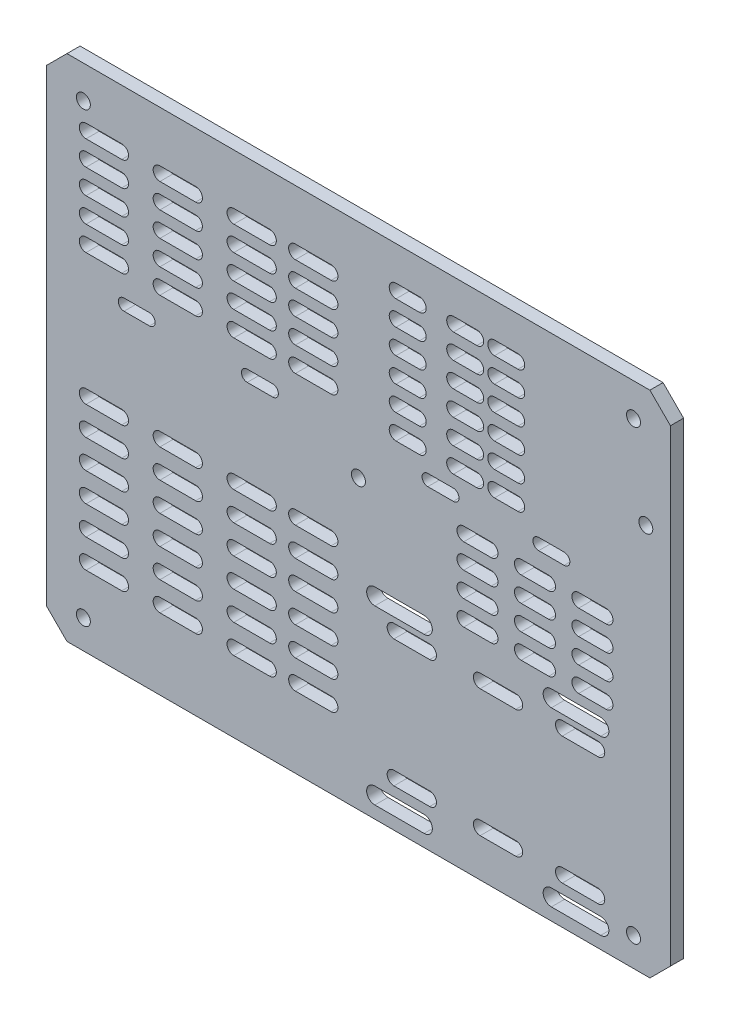
from build123d import *

# Parameters (mm, degrees)
F_3_2_MOUNTING_PLATE_SCREW_AND_STRAP_2_R       = 1.7
F_3_2_MOUNTING_PLATE_SCREW_AND_STRAP_THR_DEPTH = 3.2


with BuildPart() as part:
    # 3.2 mounting plate - screw and strap 2 → 3.2 mounting plate - screw and strap thr (new body)
    with BuildSketch(Plane.XY):
        Polygon((-71, -62), (71, -62), (76, -57), (76, 57), (71, 62), (-71, 62), (-76, 57), (-76, -57), align=None)
        with Locations((-67, -55)):
            Circle(F_3_2_MOUNTING_PLATE_SCREW_AND_STRAP_2_R, mode=Mode.SUBTRACT)
        with Locations((-67, 54)):
            Circle(F_3_2_MOUNTING_PLATE_SCREW_AND_STRAP_2_R, mode=Mode.SUBTRACT)
        with Locations((67, -55)):
            Circle(F_3_2_MOUNTING_PLATE_SCREW_AND_STRAP_2_R, mode=Mode.SUBTRACT)
        with Locations((67, 54)):
            Circle(F_3_2_MOUNTING_PLATE_SCREW_AND_STRAP_2_R, mode=Mode.SUBTRACT)
        with Locations((0, 8)):
            Circle(F_3_2_MOUNTING_PLATE_SCREW_AND_STRAP_2_R, mode=Mode.SUBTRACT)
        with Locations((70, 33)):
            Circle(F_3_2_MOUNTING_PLATE_SCREW_AND_STRAP_2_R, mode=Mode.SUBTRACT)
        with BuildLine():
            Line((-66.35, 22.35), (-57.65, 22.35))
            ThreePointArc((-57.65, 22.35), (-56, 24), (-57.65, 25.65))
            Line((-57.65, 25.65), (-66.35, 25.65))
            ThreePointArc((-66.35, 25.65), (-68, 24), (-66.35, 22.35))
        make_face(mode=Mode.SUBTRACT)
        with BuildLine():
            Line((-48.35, 22.35), (-39.65, 22.35))
            ThreePointArc((-39.65, 22.35), (-38, 24), (-39.65, 25.65))
            Line((-39.65, 25.65), (-48.35, 25.65))
            ThreePointArc((-48.35, 25.65), (-50, 24), (-48.35, 22.35))
        make_face(mode=Mode.SUBTRACT)
        with BuildLine():
            Line((-30.35, 22.35), (-21.65, 22.35))
            ThreePointArc((-21.65, 22.35), (-20, 24), (-21.65, 25.65))
            Line((-21.65, 25.65), (-30.35, 25.65))
            ThreePointArc((-30.35, 25.65), (-32, 24), (-30.35, 22.35))
        make_face(mode=Mode.SUBTRACT)
        with BuildLine():
            Line((-15.35, 22.35), (-6.65, 22.35))
            ThreePointArc((-6.65, 22.35), (-5, 24), (-6.65, 25.65))
            Line((-6.65, 25.65), (-15.35, 25.65))
            ThreePointArc((-15.35, 25.65), (-17, 24), (-15.35, 22.35))
        make_face(mode=Mode.SUBTRACT)
        with BuildLine():
            Line((-66.35, 28.35), (-57.65, 28.35))
            ThreePointArc((-57.65, 28.35), (-56, 30), (-57.65, 31.65))
            Line((-57.65, 31.65), (-66.35, 31.65))
            ThreePointArc((-66.35, 31.65), (-68, 30), (-66.35, 28.35))
        make_face(mode=Mode.SUBTRACT)
        with BuildLine():
            Line((-48.35, 28.35), (-39.65, 28.35))
            ThreePointArc((-39.65, 28.35), (-38, 30), (-39.65, 31.65))
            Line((-39.65, 31.65), (-48.35, 31.65))
            ThreePointArc((-48.35, 31.65), (-50, 30), (-48.35, 28.35))
        make_face(mode=Mode.SUBTRACT)
        with BuildLine():
            Line((-30.35, 28.35), (-21.65, 28.35))
            ThreePointArc((-21.65, 28.35), (-20, 30), (-21.65, 31.65))
            Line((-21.65, 31.65), (-30.35, 31.65))
            ThreePointArc((-30.35, 31.65), (-32, 30), (-30.35, 28.35))
        make_face(mode=Mode.SUBTRACT)
        with BuildLine():
            Line((-15.35, 28.35), (-6.65, 28.35))
            ThreePointArc((-6.65, 28.35), (-5, 30), (-6.65, 31.65))
            Line((-6.65, 31.65), (-15.35, 31.65))
            ThreePointArc((-15.35, 31.65), (-17, 30), (-15.35, 28.35))
        make_face(mode=Mode.SUBTRACT)
        with BuildLine():
            Line((-66.35, 34.35), (-57.65, 34.35))
            ThreePointArc((-57.65, 34.35), (-56, 36), (-57.65, 37.65))
            Line((-57.65, 37.65), (-66.35, 37.65))
            ThreePointArc((-66.35, 37.65), (-68, 36), (-66.35, 34.35))
        make_face(mode=Mode.SUBTRACT)
        with BuildLine():
            Line((-48.35, 34.35), (-39.65, 34.35))
            ThreePointArc((-39.65, 34.35), (-38, 36), (-39.65, 37.65))
            Line((-39.65, 37.65), (-48.35, 37.65))
            ThreePointArc((-48.35, 37.65), (-50, 36), (-48.35, 34.35))
        make_face(mode=Mode.SUBTRACT)
        with BuildLine():
            Line((-30.35, 34.35), (-21.65, 34.35))
            ThreePointArc((-21.65, 34.35), (-20, 36), (-21.65, 37.65))
            Line((-21.65, 37.65), (-30.35, 37.65))
            ThreePointArc((-30.35, 37.65), (-32, 36), (-30.35, 34.35))
        make_face(mode=Mode.SUBTRACT)
        with BuildLine():
            Line((-15.35, 34.35), (-6.65, 34.35))
            ThreePointArc((-6.65, 34.35), (-5, 36), (-6.65, 37.65))
            Line((-6.65, 37.65), (-15.35, 37.65))
            ThreePointArc((-15.35, 37.65), (-17, 36), (-15.35, 34.35))
        make_face(mode=Mode.SUBTRACT)
        with BuildLine():
            Line((-66.35, 40.35), (-57.65, 40.35))
            ThreePointArc((-57.65, 40.35), (-56, 42), (-57.65, 43.65))
            Line((-57.65, 43.65), (-66.35, 43.65))
            ThreePointArc((-66.35, 43.65), (-68, 42), (-66.35, 40.35))
        make_face(mode=Mode.SUBTRACT)
        with BuildLine():
            Line((-48.35, 40.35), (-39.65, 40.35))
            ThreePointArc((-39.65, 40.35), (-38, 42), (-39.65, 43.65))
            Line((-39.65, 43.65), (-48.35, 43.65))
            ThreePointArc((-48.35, 43.65), (-50, 42), (-48.35, 40.35))
        make_face(mode=Mode.SUBTRACT)
        with BuildLine():
            Line((-30.35, 40.35), (-21.65, 40.35))
            ThreePointArc((-21.65, 40.35), (-20, 42), (-21.65, 43.65))
            Line((-21.65, 43.65), (-30.35, 43.65))
            ThreePointArc((-30.35, 43.65), (-32, 42), (-30.35, 40.35))
        make_face(mode=Mode.SUBTRACT)
        with BuildLine():
            Line((-15.35, 40.35), (-6.65, 40.35))
            ThreePointArc((-6.65, 40.35), (-5, 42), (-6.65, 43.65))
            Line((-6.65, 43.65), (-15.35, 43.65))
            ThreePointArc((-15.35, 43.65), (-17, 42), (-15.35, 40.35))
        make_face(mode=Mode.SUBTRACT)
        with BuildLine():
            Line((-66.35, 46.35), (-57.65, 46.35))
            ThreePointArc((-57.65, 46.35), (-56, 48), (-57.65, 49.65))
            Line((-57.65, 49.65), (-66.35, 49.65))
            ThreePointArc((-66.35, 49.65), (-68, 48), (-66.35, 46.35))
        make_face(mode=Mode.SUBTRACT)
        with BuildLine():
            Line((-48.35, 46.35), (-39.65, 46.35))
            ThreePointArc((-39.65, 46.35), (-38, 48), (-39.65, 49.65))
            Line((-39.65, 49.65), (-48.35, 49.65))
            ThreePointArc((-48.35, 49.65), (-50, 48), (-48.35, 46.35))
        make_face(mode=Mode.SUBTRACT)
        with BuildLine():
            Line((-30.35, 46.35), (-21.65, 46.35))
            ThreePointArc((-21.65, 46.35), (-20, 48), (-21.65, 49.65))
            Line((-21.65, 49.65), (-30.35, 49.65))
            ThreePointArc((-30.35, 49.65), (-32, 48), (-30.35, 46.35))
        make_face(mode=Mode.SUBTRACT)
        with BuildLine():
            Line((-15.35, 46.35), (-6.65, 46.35))
            ThreePointArc((-6.65, 46.35), (-5, 48), (-6.65, 49.65))
            Line((-6.65, 49.65), (-15.35, 49.65))
            ThreePointArc((-15.35, 49.65), (-17, 48), (-15.35, 46.35))
        make_face(mode=Mode.SUBTRACT)
        with BuildLine():
            Line((-66.35, -44.65), (-57.65, -44.65))
            ThreePointArc((-57.65, -44.65), (-56, -43), (-57.65, -41.35))
            Line((-57.65, -41.35), (-66.35, -41.35))
            ThreePointArc((-66.35, -41.35), (-68, -43), (-66.35, -44.65))
        make_face(mode=Mode.SUBTRACT)
        with BuildLine():
            Line((-48.35, -44.65), (-39.65, -44.65))
            ThreePointArc((-39.65, -44.65), (-38, -43), (-39.65, -41.35))
            Line((-39.65, -41.35), (-48.35, -41.35))
            ThreePointArc((-48.35, -41.35), (-50, -43), (-48.35, -44.65))
        make_face(mode=Mode.SUBTRACT)
        with BuildLine():
            Line((-30.35, -44.65), (-21.65, -44.65))
            ThreePointArc((-21.65, -44.65), (-20, -43), (-21.65, -41.35))
            Line((-21.65, -41.35), (-30.35, -41.35))
            ThreePointArc((-30.35, -41.35), (-32, -43), (-30.35, -44.65))
        make_face(mode=Mode.SUBTRACT)
        with BuildLine():
            Line((-15.35, -44.65), (-6.65, -44.65))
            ThreePointArc((-6.65, -44.65), (-5, -43), (-6.65, -41.35))
            Line((-6.65, -41.35), (-15.35, -41.35))
            ThreePointArc((-15.35, -41.35), (-17, -43), (-15.35, -44.65))
        make_face(mode=Mode.SUBTRACT)
        with BuildLine():
            Line((-66.35, -37.65), (-57.65, -37.65))
            ThreePointArc((-57.65, -37.65), (-56, -36), (-57.65, -34.35))
            Line((-57.65, -34.35), (-66.35, -34.35))
            ThreePointArc((-66.35, -34.35), (-68, -36), (-66.35, -37.65))
        make_face(mode=Mode.SUBTRACT)
        with BuildLine():
            Line((-48.35, -37.65), (-39.65, -37.65))
            ThreePointArc((-39.65, -37.65), (-38, -36), (-39.65, -34.35))
            Line((-39.65, -34.35), (-48.35, -34.35))
            ThreePointArc((-48.35, -34.35), (-50, -36), (-48.35, -37.65))
        make_face(mode=Mode.SUBTRACT)
        with BuildLine():
            Line((-30.35, -37.65), (-21.65, -37.65))
            ThreePointArc((-21.65, -37.65), (-20, -36), (-21.65, -34.35))
            Line((-21.65, -34.35), (-30.35, -34.35))
            ThreePointArc((-30.35, -34.35), (-32, -36), (-30.35, -37.65))
        make_face(mode=Mode.SUBTRACT)
        with BuildLine():
            Line((-15.35, -37.65), (-6.65, -37.65))
            ThreePointArc((-6.65, -37.65), (-5, -36), (-6.65, -34.35))
            Line((-6.65, -34.35), (-15.35, -34.35))
            ThreePointArc((-15.35, -34.35), (-17, -36), (-15.35, -37.65))
        make_face(mode=Mode.SUBTRACT)
        with BuildLine():
            Line((-66.35, -30.65), (-57.65, -30.65))
            ThreePointArc((-57.65, -30.65), (-56, -29), (-57.65, -27.35))
            Line((-57.65, -27.35), (-66.35, -27.35))
            ThreePointArc((-66.35, -27.35), (-68, -29), (-66.35, -30.65))
        make_face(mode=Mode.SUBTRACT)
        with BuildLine():
            Line((-48.35, -30.65), (-39.65, -30.65))
            ThreePointArc((-39.65, -30.65), (-38, -29), (-39.65, -27.35))
            Line((-39.65, -27.35), (-48.35, -27.35))
            ThreePointArc((-48.35, -27.35), (-50, -29), (-48.35, -30.65))
        make_face(mode=Mode.SUBTRACT)
        with BuildLine():
            Line((-30.35, -30.65), (-21.65, -30.65))
            ThreePointArc((-21.65, -30.65), (-20, -29), (-21.65, -27.35))
            Line((-21.65, -27.35), (-30.35, -27.35))
            ThreePointArc((-30.35, -27.35), (-32, -29), (-30.35, -30.65))
        make_face(mode=Mode.SUBTRACT)
        with BuildLine():
            Line((-15.35, -30.65), (-6.65, -30.65))
            ThreePointArc((-6.65, -30.65), (-5, -29), (-6.65, -27.35))
            Line((-6.65, -27.35), (-15.35, -27.35))
            ThreePointArc((-15.35, -27.35), (-17, -29), (-15.35, -30.65))
        make_face(mode=Mode.SUBTRACT)
        with BuildLine():
            Line((-66.35, -23.65), (-57.65, -23.65))
            ThreePointArc((-57.65, -23.65), (-56, -22), (-57.65, -20.35))
            Line((-57.65, -20.35), (-66.35, -20.35))
            ThreePointArc((-66.35, -20.35), (-68, -22), (-66.35, -23.65))
        make_face(mode=Mode.SUBTRACT)
        with BuildLine():
            Line((-48.35, -23.65), (-39.65, -23.65))
            ThreePointArc((-39.65, -23.65), (-38, -22), (-39.65, -20.35))
            Line((-39.65, -20.35), (-48.35, -20.35))
            ThreePointArc((-48.35, -20.35), (-50, -22), (-48.35, -23.65))
        make_face(mode=Mode.SUBTRACT)
        with BuildLine():
            Line((-30.35, -23.65), (-21.65, -23.65))
            ThreePointArc((-21.65, -23.65), (-20, -22), (-21.65, -20.35))
            Line((-21.65, -20.35), (-30.35, -20.35))
            ThreePointArc((-30.35, -20.35), (-32, -22), (-30.35, -23.65))
        make_face(mode=Mode.SUBTRACT)
        with BuildLine():
            Line((-15.35, -23.65), (-6.65, -23.65))
            ThreePointArc((-6.65, -23.65), (-5, -22), (-6.65, -20.35))
            Line((-6.65, -20.35), (-15.35, -20.35))
            ThreePointArc((-15.35, -20.35), (-17, -22), (-15.35, -23.65))
        make_face(mode=Mode.SUBTRACT)
        with BuildLine():
            Line((-66.35, -16.65), (-57.65, -16.65))
            ThreePointArc((-57.65, -16.65), (-56, -15), (-57.65, -13.35))
            Line((-57.65, -13.35), (-66.35, -13.35))
            ThreePointArc((-66.35, -13.35), (-68, -15), (-66.35, -16.65))
        make_face(mode=Mode.SUBTRACT)
        with BuildLine():
            Line((-48.35, -16.65), (-39.65, -16.65))
            ThreePointArc((-39.65, -16.65), (-38, -15), (-39.65, -13.35))
            Line((-39.65, -13.35), (-48.35, -13.35))
            ThreePointArc((-48.35, -13.35), (-50, -15), (-48.35, -16.65))
        make_face(mode=Mode.SUBTRACT)
        with BuildLine():
            Line((-30.35, -16.65), (-21.65, -16.65))
            ThreePointArc((-21.65, -16.65), (-20, -15), (-21.65, -13.35))
            Line((-21.65, -13.35), (-30.35, -13.35))
            ThreePointArc((-30.35, -13.35), (-32, -15), (-30.35, -16.65))
        make_face(mode=Mode.SUBTRACT)
        with BuildLine():
            Line((-15.35, -16.65), (-6.65, -16.65))
            ThreePointArc((-6.65, -16.65), (-5, -15), (-6.65, -13.35))
            Line((-6.65, -13.35), (-15.35, -13.35))
            ThreePointArc((-15.35, -13.35), (-17, -15), (-15.35, -16.65))
        make_face(mode=Mode.SUBTRACT)
        with BuildLine():
            Line((-66.35, -9.65), (-57.65, -9.65))
            ThreePointArc((-57.65, -9.65), (-56, -8), (-57.65, -6.35))
            Line((-57.65, -6.35), (-66.35, -6.35))
            ThreePointArc((-66.35, -6.35), (-68, -8), (-66.35, -9.65))
        make_face(mode=Mode.SUBTRACT)
        with BuildLine():
            Line((-48.35, -9.65), (-39.65, -9.65))
            ThreePointArc((-39.65, -9.65), (-38, -8), (-39.65, -6.35))
            Line((-39.65, -6.35), (-48.35, -6.35))
            ThreePointArc((-48.35, -6.35), (-50, -8), (-48.35, -9.65))
        make_face(mode=Mode.SUBTRACT)
        with BuildLine():
            Line((-30.35, -9.65), (-21.65, -9.65))
            ThreePointArc((-21.65, -9.65), (-20, -8), (-21.65, -6.35))
            Line((-21.65, -6.35), (-30.35, -6.35))
            ThreePointArc((-30.35, -6.35), (-32, -8), (-30.35, -9.65))
        make_face(mode=Mode.SUBTRACT)
        with BuildLine():
            Line((-15.35, -9.65), (-6.65, -9.65))
            ThreePointArc((-6.65, -9.65), (-5, -8), (-6.65, -6.35))
            Line((-6.65, -6.35), (-15.35, -6.35))
            ThreePointArc((-15.35, -6.35), (-17, -8), (-15.35, -9.65))
        make_face(mode=Mode.SUBTRACT)
        with BuildLine():
            Line((9.15, 20.35), (14.85, 20.35))
            ThreePointArc((14.85, 20.35), (16.5, 22), (14.85, 23.65))
            Line((14.85, 23.65), (9.15, 23.65))
            ThreePointArc((9.15, 23.65), (7.5, 22), (9.15, 20.35))
        make_face(mode=Mode.SUBTRACT)
        with BuildLine():
            Line((23.15, 20.35), (28.85, 20.35))
            ThreePointArc((28.85, 20.35), (30.5, 22), (28.85, 23.65))
            Line((28.85, 23.65), (23.15, 23.65))
            ThreePointArc((23.15, 23.65), (21.5, 22), (23.15, 20.35))
        make_face(mode=Mode.SUBTRACT)
        with BuildLine():
            Line((33.15, 20.35), (38.85, 20.35))
            ThreePointArc((38.85, 20.35), (40.5, 22), (38.85, 23.65))
            Line((38.85, 23.65), (33.15, 23.65))
            ThreePointArc((33.15, 23.65), (31.5, 22), (33.15, 20.35))
        make_face(mode=Mode.SUBTRACT)
        with BuildLine():
            Line((9.15, 26.35), (14.85, 26.35))
            ThreePointArc((14.85, 26.35), (16.5, 28), (14.85, 29.65))
            Line((14.85, 29.65), (9.15, 29.65))
            ThreePointArc((9.15, 29.65), (7.5, 28), (9.15, 26.35))
        make_face(mode=Mode.SUBTRACT)
        with BuildLine():
            Line((23.15, 26.35), (28.85, 26.35))
            ThreePointArc((28.85, 26.35), (30.5, 28), (28.85, 29.65))
            Line((28.85, 29.65), (23.15, 29.65))
            ThreePointArc((23.15, 29.65), (21.5, 28), (23.15, 26.35))
        make_face(mode=Mode.SUBTRACT)
        with BuildLine():
            Line((33.15, 26.35), (38.85, 26.35))
            ThreePointArc((38.85, 26.35), (40.5, 28), (38.85, 29.65))
            Line((38.85, 29.65), (33.15, 29.65))
            ThreePointArc((33.15, 29.65), (31.5, 28), (33.15, 26.35))
        make_face(mode=Mode.SUBTRACT)
        with BuildLine():
            Line((9.15, 32.35), (14.85, 32.35))
            ThreePointArc((14.85, 32.35), (16.5, 34), (14.85, 35.65))
            Line((14.85, 35.65), (9.15, 35.65))
            ThreePointArc((9.15, 35.65), (7.5, 34), (9.15, 32.35))
        make_face(mode=Mode.SUBTRACT)
        with BuildLine():
            Line((23.15, 32.35), (28.85, 32.35))
            ThreePointArc((28.85, 32.35), (30.5, 34), (28.85, 35.65))
            Line((28.85, 35.65), (23.15, 35.65))
            ThreePointArc((23.15, 35.65), (21.5, 34), (23.15, 32.35))
        make_face(mode=Mode.SUBTRACT)
        with BuildLine():
            Line((33.15, 32.35), (38.85, 32.35))
            ThreePointArc((38.85, 32.35), (40.5, 34), (38.85, 35.65))
            Line((38.85, 35.65), (33.15, 35.65))
            ThreePointArc((33.15, 35.65), (31.5, 34), (33.15, 32.35))
        make_face(mode=Mode.SUBTRACT)
        with BuildLine():
            Line((9.15, 38.35), (14.85, 38.35))
            ThreePointArc((14.85, 38.35), (16.5, 40), (14.85, 41.65))
            Line((14.85, 41.65), (9.15, 41.65))
            ThreePointArc((9.15, 41.65), (7.5, 40), (9.15, 38.35))
        make_face(mode=Mode.SUBTRACT)
        with BuildLine():
            Line((23.15, 38.35), (28.85, 38.35))
            ThreePointArc((28.85, 38.35), (30.5, 40), (28.85, 41.65))
            Line((28.85, 41.65), (23.15, 41.65))
            ThreePointArc((23.15, 41.65), (21.5, 40), (23.15, 38.35))
        make_face(mode=Mode.SUBTRACT)
        with BuildLine():
            Line((33.15, 38.35), (38.85, 38.35))
            ThreePointArc((38.85, 38.35), (40.5, 40), (38.85, 41.65))
            Line((38.85, 41.65), (33.15, 41.65))
            ThreePointArc((33.15, 41.65), (31.5, 40), (33.15, 38.35))
        make_face(mode=Mode.SUBTRACT)
        with BuildLine():
            Line((9.15, 44.35), (14.85, 44.35))
            ThreePointArc((14.85, 44.35), (16.5, 46), (14.85, 47.65))
            Line((14.85, 47.65), (9.15, 47.65))
            ThreePointArc((9.15, 47.65), (7.5, 46), (9.15, 44.35))
        make_face(mode=Mode.SUBTRACT)
        with BuildLine():
            Line((23.15, 44.35), (28.85, 44.35))
            ThreePointArc((28.85, 44.35), (30.5, 46), (28.85, 47.65))
            Line((28.85, 47.65), (23.15, 47.65))
            ThreePointArc((23.15, 47.65), (21.5, 46), (23.15, 44.35))
        make_face(mode=Mode.SUBTRACT)
        with BuildLine():
            Line((33.15, 44.35), (38.85, 44.35))
            ThreePointArc((38.85, 44.35), (40.5, 46), (38.85, 47.65))
            Line((38.85, 47.65), (33.15, 47.65))
            ThreePointArc((33.15, 47.65), (31.5, 46), (33.15, 44.35))
        make_face(mode=Mode.SUBTRACT)
        with BuildLine():
            Line((9.15, 50.35), (14.85, 50.35))
            ThreePointArc((14.85, 50.35), (16.5, 52), (14.85, 53.65))
            Line((14.85, 53.65), (9.15, 53.65))
            ThreePointArc((9.15, 53.65), (7.5, 52), (9.15, 50.35))
        make_face(mode=Mode.SUBTRACT)
        with BuildLine():
            Line((23.15, 50.35), (28.85, 50.35))
            ThreePointArc((28.85, 50.35), (30.5, 52), (28.85, 53.65))
            Line((28.85, 53.65), (23.15, 53.65))
            ThreePointArc((23.15, 53.65), (21.5, 52), (23.15, 50.35))
        make_face(mode=Mode.SUBTRACT)
        with BuildLine():
            Line((33.15, 50.35), (38.85, 50.35))
            ThreePointArc((38.85, 50.35), (40.5, 52), (38.85, 53.65))
            Line((38.85, 53.65), (33.15, 53.65))
            ThreePointArc((33.15, 53.65), (31.5, 52), (33.15, 50.35))
        make_face(mode=Mode.SUBTRACT)
        with BuildLine():
            Line((25.65, -10.65), (32.35, -10.65))
            ThreePointArc((32.35, -10.65), (34, -9), (32.35, -7.35))
            Line((32.35, -7.35), (25.65, -7.35))
            ThreePointArc((25.65, -7.35), (24, -9), (25.65, -10.65))
        make_face(mode=Mode.SUBTRACT)
        with BuildLine():
            Line((39.65, -10.65), (46.35, -10.65))
            ThreePointArc((46.35, -10.65), (48, -9), (46.35, -7.35))
            Line((46.35, -7.35), (39.65, -7.35))
            ThreePointArc((39.65, -7.35), (38, -9), (39.65, -10.65))
        make_face(mode=Mode.SUBTRACT)
        with BuildLine():
            Line((53.65, -10.65), (60.35, -10.65))
            ThreePointArc((60.35, -10.65), (62, -9), (60.35, -7.35))
            Line((60.35, -7.35), (53.65, -7.35))
            ThreePointArc((53.65, -7.35), (52, -9), (53.65, -10.65))
        make_face(mode=Mode.SUBTRACT)
        with BuildLine():
            Line((25.65, -4.65), (32.35, -4.65))
            ThreePointArc((32.35, -4.65), (34, -3), (32.35, -1.35))
            Line((32.35, -1.35), (25.65, -1.35))
            ThreePointArc((25.65, -1.35), (24, -3), (25.65, -4.65))
        make_face(mode=Mode.SUBTRACT)
        with BuildLine():
            Line((39.65, -4.65), (46.35, -4.65))
            ThreePointArc((46.35, -4.65), (48, -3), (46.35, -1.35))
            Line((46.35, -1.35), (39.65, -1.35))
            ThreePointArc((39.65, -1.35), (38, -3), (39.65, -4.65))
        make_face(mode=Mode.SUBTRACT)
        with BuildLine():
            Line((53.65, -4.65), (60.35, -4.65))
            ThreePointArc((60.35, -4.65), (62, -3), (60.35, -1.35))
            Line((60.35, -1.35), (53.65, -1.35))
            ThreePointArc((53.65, -1.35), (52, -3), (53.65, -4.65))
        make_face(mode=Mode.SUBTRACT)
        with BuildLine():
            Line((25.65, 1.35), (32.35, 1.35))
            ThreePointArc((32.35, 1.35), (34, 3), (32.35, 4.65))
            Line((32.35, 4.65), (25.65, 4.65))
            ThreePointArc((25.65, 4.65), (24, 3), (25.65, 1.35))
        make_face(mode=Mode.SUBTRACT)
        with BuildLine():
            Line((39.65, 1.35), (46.35, 1.35))
            ThreePointArc((46.35, 1.35), (48, 3), (46.35, 4.65))
            Line((46.35, 4.65), (39.65, 4.65))
            ThreePointArc((39.65, 4.65), (38, 3), (39.65, 1.35))
        make_face(mode=Mode.SUBTRACT)
        with BuildLine():
            Line((53.65, 1.35), (60.35, 1.35))
            ThreePointArc((60.35, 1.35), (62, 3), (60.35, 4.65))
            Line((60.35, 4.65), (53.65, 4.65))
            ThreePointArc((53.65, 4.65), (52, 3), (53.65, 1.35))
        make_face(mode=Mode.SUBTRACT)
        with BuildLine():
            Line((25.65, 7.35), (32.35, 7.35))
            ThreePointArc((32.35, 7.35), (34, 9), (32.35, 10.65))
            Line((32.35, 10.65), (25.65, 10.65))
            ThreePointArc((25.65, 10.65), (24, 9), (25.65, 7.35))
        make_face(mode=Mode.SUBTRACT)
        with BuildLine():
            Line((39.65, 7.35), (46.35, 7.35))
            ThreePointArc((46.35, 7.35), (48, 9), (46.35, 10.65))
            Line((46.35, 10.65), (39.65, 10.65))
            ThreePointArc((39.65, 10.65), (38, 9), (39.65, 7.35))
        make_face(mode=Mode.SUBTRACT)
        with BuildLine():
            Line((53.65, 7.35), (60.35, 7.35))
            ThreePointArc((60.35, 7.35), (62, 9), (60.35, 10.65))
            Line((60.35, 10.65), (53.65, 10.65))
            ThreePointArc((53.65, 10.65), (52, 9), (53.65, 7.35))
        make_face(mode=Mode.SUBTRACT)
        with BuildLine():
            Line((4, -59), (16, -59))
            ThreePointArc((16, -59), (18, -57), (16, -55))
            Line((16, -55), (4, -55))
            ThreePointArc((4, -55), (2, -57), (4, -59))
        make_face(mode=Mode.SUBTRACT)
        with BuildLine():
            Line((47, -59), (59, -59))
            ThreePointArc((59, -59), (61, -57), (59, -55))
            Line((59, -55), (47, -55))
            ThreePointArc((47, -55), (45, -57), (47, -59))
        make_face(mode=Mode.SUBTRACT)
        with BuildLine():
            Line((4, -17), (16, -17))
            ThreePointArc((16, -17), (18, -15), (16, -13))
            Line((16, -13), (4, -13))
            ThreePointArc((4, -13), (2, -15), (4, -17))
        make_face(mode=Mode.SUBTRACT)
        with BuildLine():
            Line((47, -17), (59, -17))
            ThreePointArc((59, -17), (61, -15), (59, -13))
            Line((59, -13), (47, -13))
            ThreePointArc((47, -13), (45, -15), (47, -17))
        make_face(mode=Mode.SUBTRACT)
        with BuildLine():
            Line((8.65, -52.65), (17.35, -52.65))
            ThreePointArc((17.35, -52.65), (19, -51), (17.35, -49.35))
            Line((17.35, -49.35), (8.65, -49.35))
            ThreePointArc((8.65, -49.35), (7, -51), (8.65, -52.65))
        make_face(mode=Mode.SUBTRACT)
        with BuildLine():
            Line((29.65, -52.65), (38.35, -52.65))
            ThreePointArc((38.35, -52.65), (40, -51), (38.35, -49.35))
            Line((38.35, -49.35), (29.65, -49.35))
            ThreePointArc((29.65, -49.35), (28, -51), (29.65, -52.65))
        make_face(mode=Mode.SUBTRACT)
        with BuildLine():
            Line((49.65, -52.65), (58.35, -52.65))
            ThreePointArc((58.35, -52.65), (60, -51), (58.35, -49.35))
            Line((58.35, -49.35), (49.65, -49.35))
            ThreePointArc((49.65, -49.35), (48, -51), (49.65, -52.65))
        make_face(mode=Mode.SUBTRACT)
        with BuildLine():
            Line((8.65, -21.65), (17.35, -21.65))
            ThreePointArc((17.35, -21.65), (19, -20), (17.35, -18.35))
            Line((17.35, -18.35), (8.65, -18.35))
            ThreePointArc((8.65, -18.35), (7, -20), (8.65, -21.65))
        make_face(mode=Mode.SUBTRACT)
        with BuildLine():
            Line((29.65, -21.65), (38.35, -21.65))
            ThreePointArc((38.35, -21.65), (40, -20), (38.35, -18.35))
            Line((38.35, -18.35), (29.65, -18.35))
            ThreePointArc((29.65, -18.35), (28, -20), (29.65, -21.65))
        make_face(mode=Mode.SUBTRACT)
        with BuildLine():
            Line((49.65, -21.65), (58.35, -21.65))
            ThreePointArc((58.35, -21.65), (60, -20), (58.35, -18.35))
            Line((58.35, -18.35), (49.65, -18.35))
            ThreePointArc((49.65, -18.35), (48, -20), (49.65, -21.65))
        make_face(mode=Mode.SUBTRACT)
        with BuildLine():
            Line((-57.1, 14.6), (-50.9, 14.6))
            ThreePointArc((-50.9, 14.6), (-49.5, 16), (-50.9, 17.4))
            Line((-50.9, 17.4), (-57.1, 17.4))
            ThreePointArc((-57.1, 17.4), (-58.5, 16), (-57.1, 14.6))
        make_face(mode=Mode.SUBTRACT)
        with BuildLine():
            Line((-27.1, 14.6), (-20.9, 14.6))
            ThreePointArc((-20.9, 14.6), (-19.5, 16), (-20.9, 17.4))
            Line((-20.9, 17.4), (-27.1, 17.4))
            ThreePointArc((-27.1, 17.4), (-28.5, 16), (-27.1, 14.6))
        make_face(mode=Mode.SUBTRACT)
        with BuildLine():
            Line((16.9, 14.6), (23.1, 14.6))
            ThreePointArc((23.1, 14.6), (24.5, 16), (23.1, 17.4))
            Line((23.1, 17.4), (16.9, 17.4))
            ThreePointArc((16.9, 17.4), (15.5, 16), (16.9, 14.6))
        make_face(mode=Mode.SUBTRACT)
        with BuildLine():
            Line((43.9, 14.6), (50.1, 14.6))
            ThreePointArc((50.1, 14.6), (51.5, 16), (50.1, 17.4))
            Line((50.1, 17.4), (43.9, 17.4))
            ThreePointArc((43.9, 17.4), (42.5, 16), (43.9, 14.6))
        make_face(mode=Mode.SUBTRACT)
    extrude(amount=F_3_2_MOUNTING_PLATE_SCREW_AND_STRAP_THR_DEPTH)


solid = part.part
